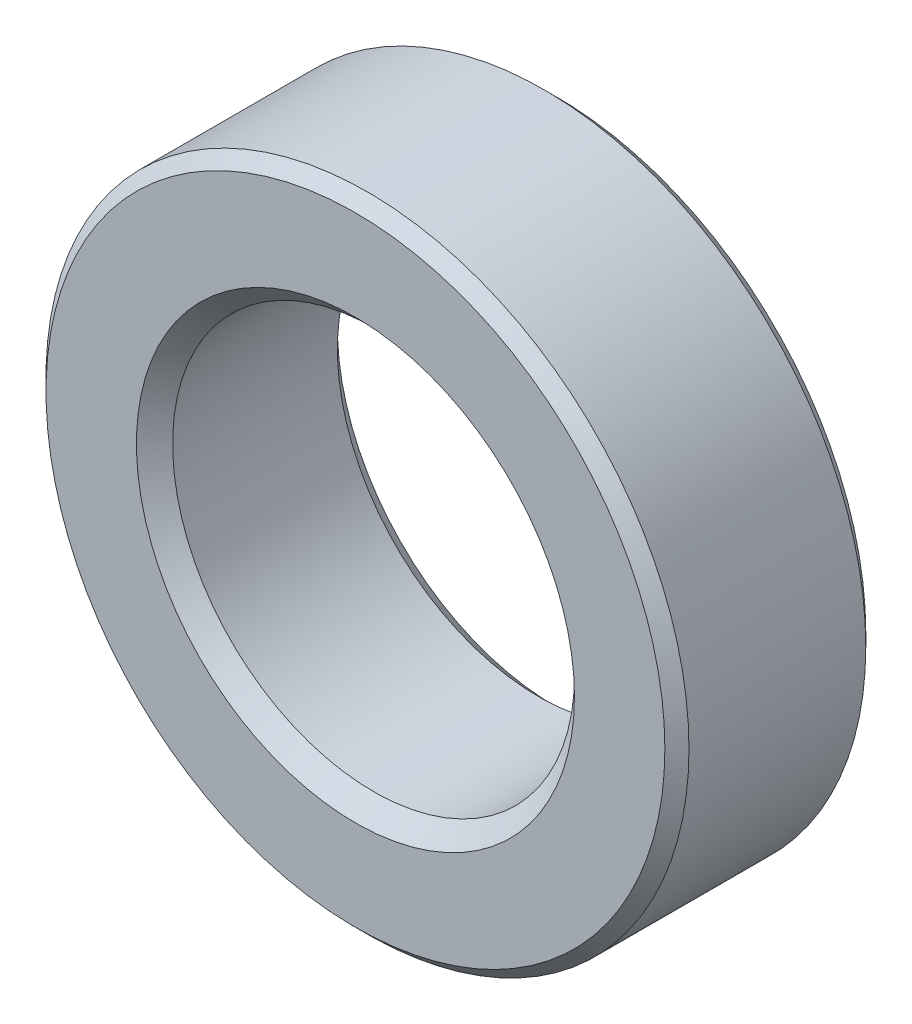
from build123d import *

# Parameters (mm, degrees)
BOSS_EXTRUDE1_DEPTH      = 2.5
BOSS_EXTRUDE1_DEPTH_BACK = 2.5
SKETCH3_R                = 8
SKETCH3_R_2              = 5
CHAMFER1_SIZE            = 0.3
CHAMFER2_SIZE            = 0.45


with BuildPart() as part:
    # Sketch3 → Boss-Extrude1 (new, two sides: drawn at the far end of the back side and taken through both)
    with BuildSketch(Plane.XY.offset(-BOSS_EXTRUDE1_DEPTH_BACK)):
        Circle(SKETCH3_R)
        Circle(SKETCH3_R_2, mode=Mode.SUBTRACT)
    extrude(amount=BOSS_EXTRUDE1_DEPTH + BOSS_EXTRUDE1_DEPTH_BACK)

    # Chamfer1
    chamfer1_edges = [part.edges().sort_by_distance(p)[0] for p in [
        (-8, 0, -2.5),
        (-8, 0, 2.5),
    ]]
    chamfer(chamfer1_edges, length=CHAMFER1_SIZE)

    # Chamfer2
    chamfer2_edges = [part.edges().sort_by_distance(p)[0] for p in [
        (-5, 0, -2.5),
        (-5, 0, 2.5),
    ]]
    chamfer(chamfer2_edges, length=CHAMFER2_SIZE)


solid = part.part
